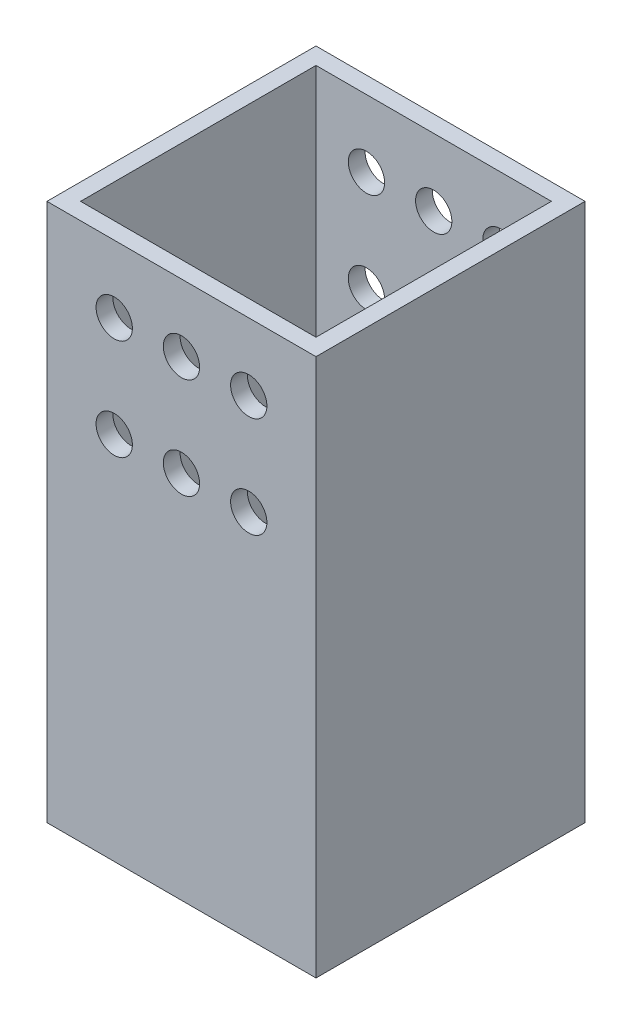
from build123d import *

# Parameters (mm, degrees)
SKETCH1_W            = 50.8
SKETCH1_H            = 50.8
SKETCH1_W_2          = 44.45
SKETCH1_H_2          = 44.45
BOSS_EXTRUDE1_DEPTH  = 101.6
SKETCH2_R            = 3.429
CUT_EXTRUDE1_DEPTH   = 101.6
LPATTERN1_COUNT      = 3
LPATTERN1_PITCH      = 12.7
LPATTERN1_COUNT_DIR2 = 2
LPATTERN1_PITCH_DIR2 = 19.05


with BuildPart() as part:
    # Sketch1 → Boss-Extrude1 (new body)
    with BuildSketch(Plane(origin=(0, 0, 0), x_dir=(1, 0, 0), z_dir=(0, 1, 0))):
        Rectangle(SKETCH1_W, SKETCH1_H)
        Rectangle(SKETCH1_W_2, SKETCH1_H_2, mode=Mode.SUBTRACT)
    extrude(amount=BOSS_EXTRUDE1_DEPTH)

    # Sketch2 → Cut-Extrude1 (cut)
    with BuildSketch(Plane.XY.offset(25.4)):
        with Locations((-12.7, 69.85)):
            Circle(SKETCH2_R)
    cut_extrude1 = extrude(amount=-CUT_EXTRUDE1_DEPTH, mode=Mode.SUBTRACT)

    # LPattern1: Cut-Extrude1 3 × 2
    with Locations(*[(i * LPATTERN1_PITCH, j * LPATTERN1_PITCH_DIR2, 0) for i in range(LPATTERN1_COUNT) for j in range(LPATTERN1_COUNT_DIR2) if (i, j) != (0, 0)]):
        add(cut_extrude1, mode=Mode.SUBTRACT)


solid = part.part
